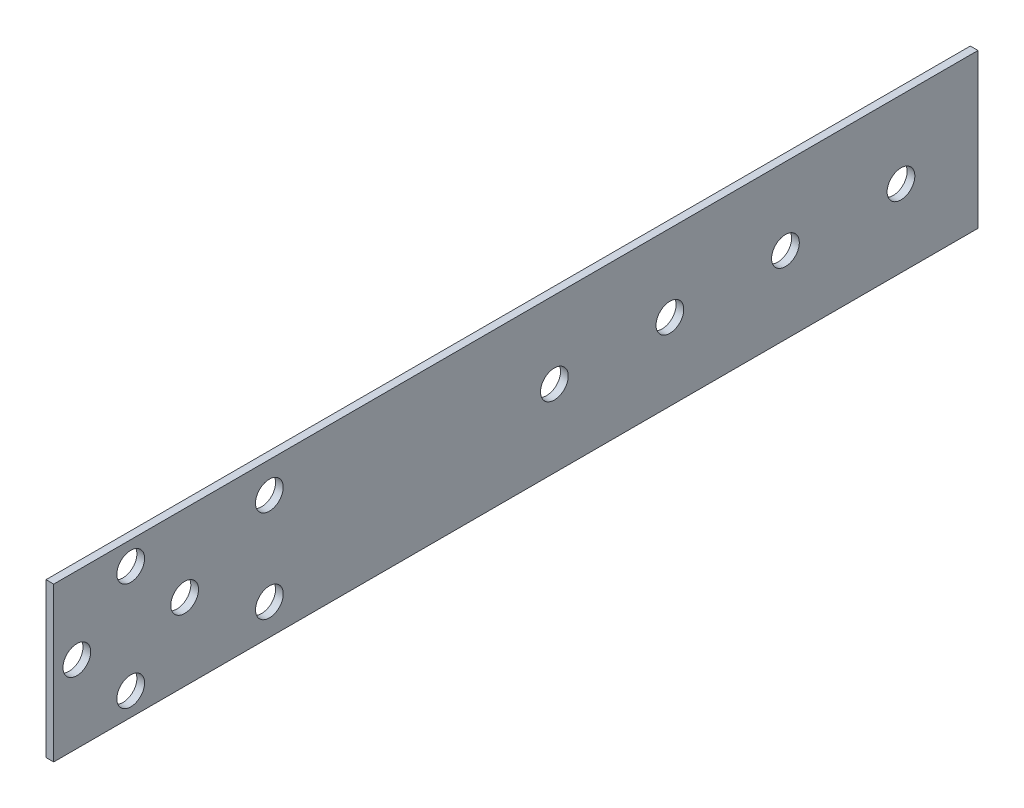
from build123d import *

# Parameters (mm, degrees)
SKETCH_1_W          = 1
SKETCH_1_H          = 120
EXTRUDE_1_DEPTH     = 20
SKETCH_2_R          = 1.8
CUT_EXTRUDE_1_DEPTH = 122.659360511
SKETCH_3_R          = 1.8
CUT_EXTRUDE_3_DEPTH = 10
SKETCH_4_R          = 1.8
CUT_EXTRUDE_4_DEPTH = 122.659360511


with BuildPart() as part:
    # 草图1 → 凸台-拉伸1 (new body)
    with BuildSketch(Plane(origin=(0, 0, 0), x_dir=(1, 0, 0), z_dir=(0, 1, 0))):
        with Locations((0.5, 60)):
            Rectangle(SKETCH_1_W, SKETCH_1_H)
    extrude(amount=EXTRUDE_1_DEPTH)

    # 草图2 → 切除-拉伸1 (cut, through all)
    with BuildSketch(Plane.ZY):
        with Locations((-10, 17)):
            Circle(SKETCH_2_R)
        with Locations((-17, 10)):
            Circle(SKETCH_2_R)
        with Locations((-3, 10)):
            Circle(SKETCH_2_R)
        with Locations((-10, 3)):
            Circle(SKETCH_2_R)
    extrude(amount=-CUT_EXTRUDE_1_DEPTH, mode=Mode.SUBTRACT)

    # 草图3 → 切除-拉伸3 (cut)
    with BuildSketch(Plane.ZY):
        with Locations((-110, 10)):
            Circle(SKETCH_3_R)
        with Locations((-95, 10)):
            Circle(SKETCH_3_R)
        with Locations((-80, 10)):
            Circle(SKETCH_3_R)
        with Locations((-65, 10)):
            Circle(SKETCH_3_R)
    extrude(amount=-CUT_EXTRUDE_3_DEPTH, mode=Mode.SUBTRACT)

    # 草图4 → 切除-拉伸4 (cut, through all)
    with BuildSketch(Plane.ZY):
        with Locations((-28, 16)):
            Circle(SKETCH_4_R)
        with Locations((-28, 4)):
            Circle(SKETCH_4_R)
    extrude(amount=-CUT_EXTRUDE_4_DEPTH, mode=Mode.SUBTRACT)


solid = part.part
